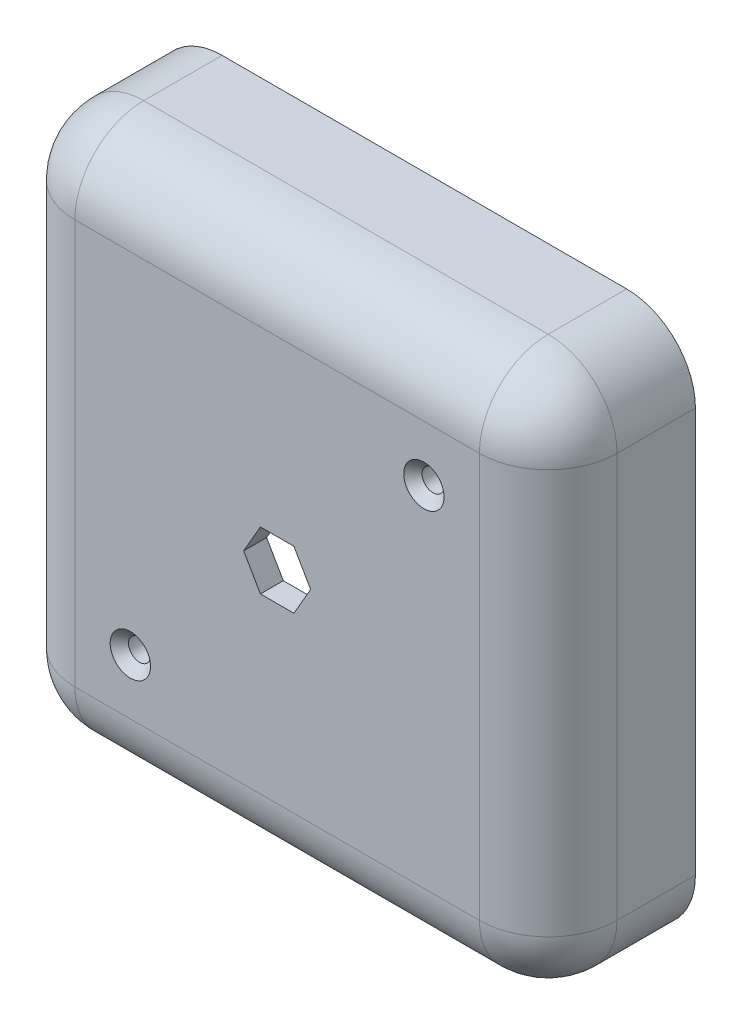
from build123d import *

# Parameters (mm, degrees)
SKETCH1_W                                            = 59.1
SKETCH1_H                                            = 59.1
BOSS_EXTRUDE1_DEPTH                                  = 59.1
CUT_EXTRUDE1_DEPTH                                   = 94.96477218
CUT_EXTRUDE1_DEPTH_BACK                              = 3.5
SKETCH2_W                                            = 96.91536242
SKETCH2_H                                            = 99.114771323
FILLET1_R                                            = 7.5
SHELL1_T                                             = -2.5
CSK_SLOT_FOR_M2_COUNTERSUNK_FLAT_HEAD_SC_D           = 2.4
CSK_SLOT_FOR_M2_COUNTERSUNK_FLAT_HEAD_SC_CSINK_D     = 4.4
CSK_SLOT_FOR_M2_COUNTERSUNK_FLAT_HEAD_SC_CSINK_ANGLE = 90
CUT_EXTRUDE2_DEPTH                                   = 45.76614234


with BuildPart() as part:
    # Sketch1 → Boss-Extrude1 (new body)
    with BuildSketch(Plane.XY):
        Rectangle(SKETCH1_W, SKETCH1_H)
    extrude(amount=BOSS_EXTRUDE1_DEPTH)

    # Sketch2 → Cut-Extrude1 (cut, two sides: drawn at the far end of the back side and taken through both)
    with BuildSketch(Plane(origin=(30.720954492, 30.720954492, 39.55), x_dir=(0.2588190451025209, -0.9659258262890682, 0), z_dir=(0, 0, -1)).offset(-CUT_EXTRUDE1_DEPTH_BACK)):
        with Locations((21.755390695, 38.565126259)):
            Rectangle(SKETCH2_W, SKETCH2_H)
    extrude(amount=CUT_EXTRUDE1_DEPTH + CUT_EXTRUDE1_DEPTH_BACK, mode=Mode.SUBTRACT)

    # Fillet1
    fillet1_edges = [part.edges().sort_by_distance(p)[0] for p in [
        (29.55, 0, 59.1),
        (0, 29.55, 59.1),
        (-29.55, 0, 59.1),
        (0, -29.55, 59.1),
        (-29.55, 29.55, 51.075),
        (29.55, 29.55, 51.075),
        (29.55, -29.55, 51.075),
        (-29.55, -29.55, 51.075),
    ]]
    fillet(fillet1_edges, radius=FILLET1_R)

    # Shell1
    shell1_openings = [part.faces().sort_by_distance(p)[0] for p in [
        (0, 0, 43.05),
    ]]
    offset(amount=SHELL1_T, openings=shell1_openings, kind=Kind.INTERSECTION)

    # CSK SLOT for M2 Countersunk Flat Head Screw1 (through all)
    with Locations(Plane.XY.offset(59.1)):
        with Locations((16, 16), (19.892963711, -96.835353), (-16, -16)):
            CounterSinkHole(CSK_SLOT_FOR_M2_COUNTERSUNK_FLAT_HEAD_SC_D / 2, CSK_SLOT_FOR_M2_COUNTERSUNK_FLAT_HEAD_SC_CSINK_D / 2, counter_sink_angle=CSK_SLOT_FOR_M2_COUNTERSUNK_FLAT_HEAD_SC_CSINK_ANGLE)

    # Sketch20 → Cut-Extrude2 (cut, through all)
    with BuildSketch(Plane.XY.offset(59.1)):
        Polygon((-1.825, -3.160992724), (1.825, -3.160992724), (3.65, 0), (1.825, 3.160992724), (-1.825, 3.160992724), (-3.65, 0), align=None)
    extrude(amount=-CUT_EXTRUDE2_DEPTH, mode=Mode.SUBTRACT)


solid = part.part
